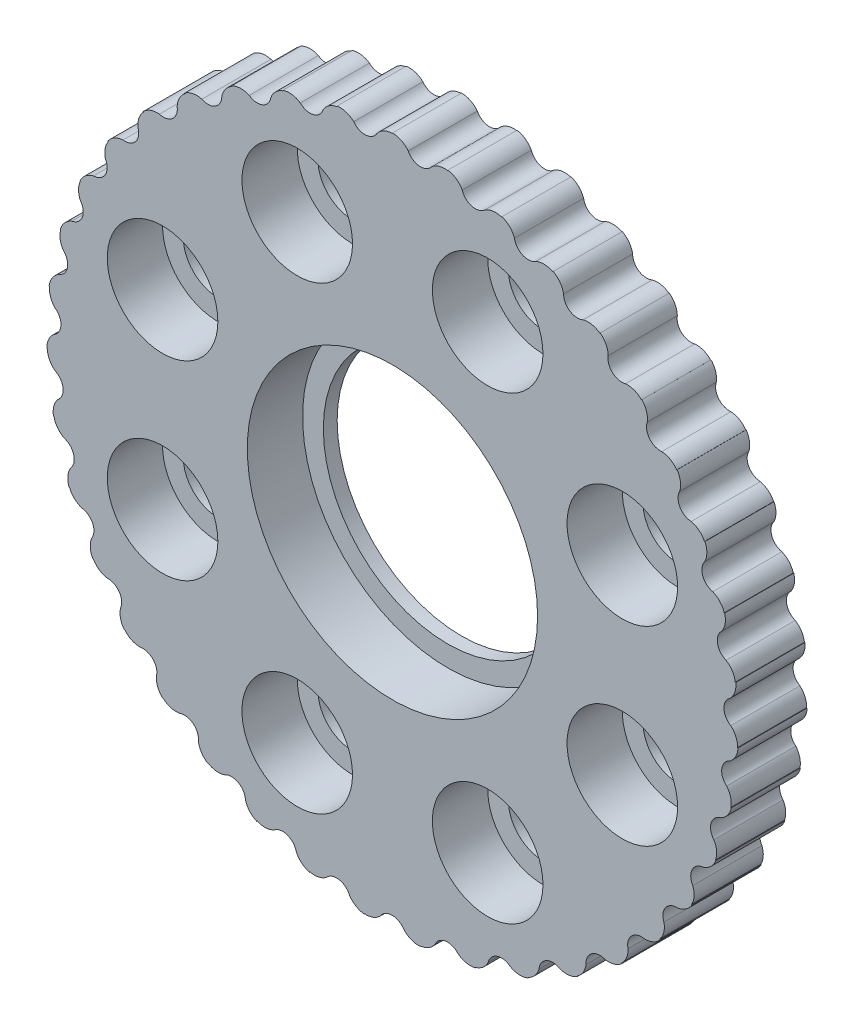
from build123d import *

# Parameters (mm, degrees)
BOSS_EXTRU_1_DEPTH           = 5
R_P_TITION_CIRCULAIRE1_COUNT = 39
ESQUISSE2_R                  = 4
ESQUISSE2_R_2                = 10.5
ENL_V_MAT_EXTRU_1_DEPTH      = 4
ESQUISSE4_R                  = 9
ESQUISSE4_R_2                = 2.5
ENL_V_MAT_EXTRU_2_DEPTH      = 36.595570443


with BuildPart() as part:
    # Esquisse1 → Boss.-Extru.1 (new body)
    with BuildSketch(Plane.XY):
        with BuildLine():
            Line((0, 25.02), (0, 0))
            Line((0, 0), (5.014186042, 23.95817368))
            ThreePointArc((5.014186042, 23.95817368), (4.003376268, 24.662026737), (2.823950163, 24.306921702))
            ThreePointArc((2.823950163, 24.306921702), (1.936687403, 23.921832984), (1.13843981, 24.468028284))
            ThreePointArc((1.13843981, 24.468028284), (0.632597419, 24.874730051), (0, 25.02))
        make_face()
    boss_extru_1 = extrude(amount=BOSS_EXTRU_1_DEPTH)

    # Répétition circulaire1: Boss.-Extru.1 ×39 about axis
    r_p_tition_circulaire1_axis = Axis((0, 0, 0), (0, 0, 1))
    for i in range(1, R_P_TITION_CIRCULAIRE1_COUNT):
        add(boss_extru_1.rotate(r_p_tition_circulaire1_axis, i * 360 / R_P_TITION_CIRCULAIRE1_COUNT))

    # Esquisse2 → Enlèv. mat.-Extru.1 (cut)
    with BuildSketch(Plane.XY.offset(5)):
        with Locations((6.888301783, 16.629831585)):
            Circle(ESQUISSE2_R)
        Circle(ESQUISSE2_R_2)
        with Locations((16.629831585, 6.888301783)):
            Circle(ESQUISSE2_R)
        with Locations((16.629831585, -6.888301783)):
            Circle(ESQUISSE2_R)
        with Locations((6.888301783, -16.629831585)):
            Circle(ESQUISSE2_R)
        with Locations((-6.888301783, -16.629831585)):
            Circle(ESQUISSE2_R)
        with Locations((-16.629831585, -6.888301783)):
            Circle(ESQUISSE2_R)
        with Locations((-16.629831585, 6.888301783)):
            Circle(ESQUISSE2_R)
        with Locations((-6.888301783, 16.629831585)):
            Circle(ESQUISSE2_R)
    extrude(amount=-ENL_V_MAT_EXTRU_1_DEPTH, mode=Mode.SUBTRACT)

    # Esquisse4 → Enlèv. mat.-Extru.2 (cut, through all)
    with BuildSketch(Plane.XY.offset(1)):
        Circle(ESQUISSE4_R)
        with Locations((6.888301783, 16.629831585)):
            Circle(ESQUISSE4_R_2)
        with Locations((16.629831585, 6.888301783)):
            Circle(ESQUISSE4_R_2)
        with Locations((16.629831585, -6.888301783)):
            Circle(ESQUISSE4_R_2)
        with Locations((6.888301783, -16.629831585)):
            Circle(ESQUISSE4_R_2)
        with Locations((-6.888301783, -16.629831585)):
            Circle(ESQUISSE4_R_2)
        with Locations((-16.629831585, -6.888301783)):
            Circle(ESQUISSE4_R_2)
        with Locations((-16.629831585, 6.888301783)):
            Circle(ESQUISSE4_R_2)
        with Locations((-6.888301783, 16.629831585)):
            Circle(ESQUISSE4_R_2)
    extrude(amount=-ENL_V_MAT_EXTRU_2_DEPTH, mode=Mode.SUBTRACT)


solid = part.part
